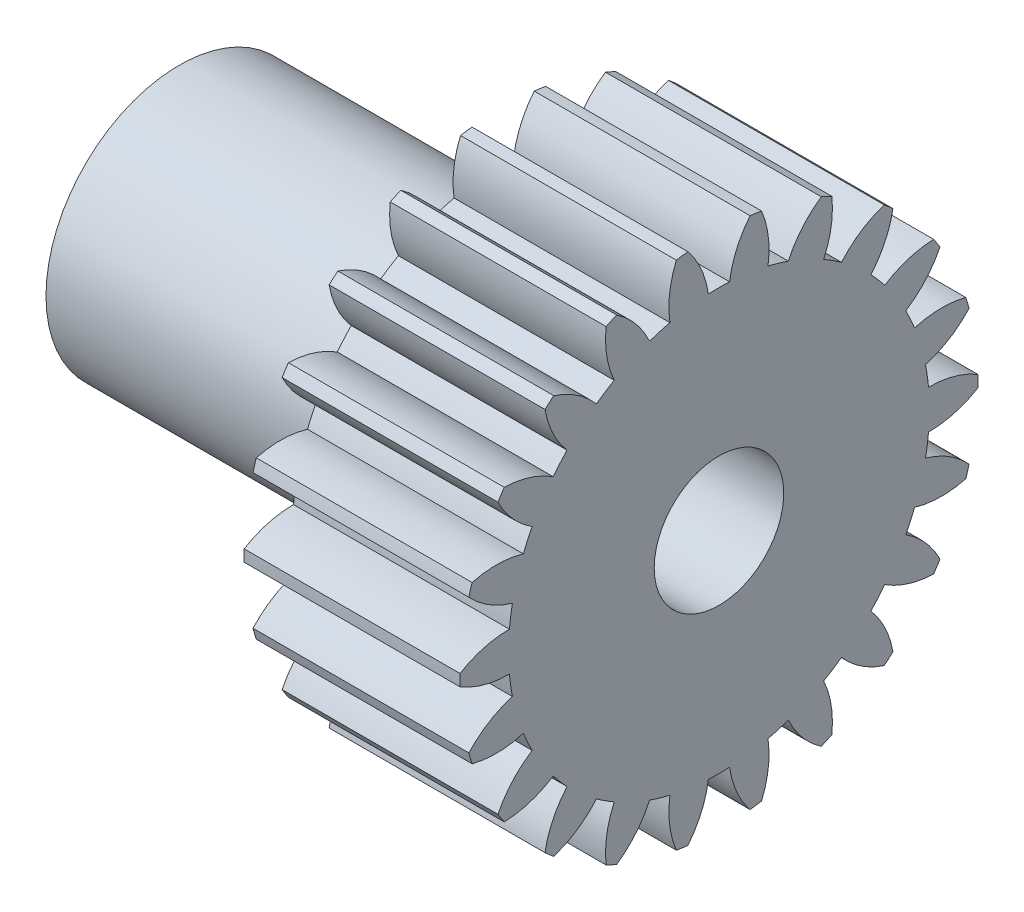
from build123d import *

# Parameters (mm, degrees)
BASPROSKE_W      = 10
BASPROSKE_H      = 12
TOOTHCUT_DEPTH   = 20.697715604
TEETHCUTS_COUNT  = 22
TEETHCUTS_ANGLE  = 343.636363636
HUBNEAONESKE_R   = 6.175
HUBNEARONE_DEPTH = 15.0000508
BORSKE_R         = 3
BORE_DEPTH       = 25.0000508


with BuildPart() as part:
    # BasProSke → Base-Revolve (revolve)
    with BuildSketch(Plane(origin=(0, 0, 0), x_dir=(1, 0, 0), z_dir=(0, 1, 0)), mode=Mode.PRIVATE) as base_revolve_sk:
        with Locations((5, 6)):
            Rectangle(BASPROSKE_W, BASPROSKE_H)
    revolve(base_revolve_sk.sketch.rotate(Axis((-10, 0, 0), (1, 0, 0)), 180), axis=Axis((-10, 0, 0), (1, 0, 0)))

    # TooCutSke → ToothCut (cut, through all)
    with BuildSketch(Plane(origin=(0, 0, 0), x_dir=(0, 0, -1), z_dir=(1, 0, 0))):
        with BuildLine():
            ThreePointArc((0.491001901, 9.736627657), (0, 9.749), (-0.491001901, 9.736627657))
            ThreePointArc((-0.491001901, 9.736627657), (-0.822824844, 10.904005344), (-1.46093845, 11.936327074))
            ThreePointArc((-1.46093845, 11.936327074), (0, 12.0254), (1.46093845, 11.936327074))
            ThreePointArc((1.46093845, 11.936327074), (0.822824844, 10.904005344), (0.491001901, 9.736627657))
        make_face()
    toothcut = extrude(amount=TOOTHCUT_DEPTH, mode=Mode.SUBTRACT)

    # TeethCuts: ToothCut ×22 about axis
    teethcuts_axis = Axis((-10, 0, 0), (1, 0, 0))
    for i in range(1, TEETHCUTS_COUNT):
        add(toothcut.rotate(teethcuts_axis, i * TEETHCUTS_ANGLE / (TEETHCUTS_COUNT - 1)), mode=Mode.SUBTRACT)

    # HubNeaOneSke → HubNearOne (add)
    with BuildSketch(Plane.ZY):
        with Locations(Location((0, 0, 0), (0, 0, 180))):
            Circle(HUBNEAONESKE_R)
    extrude(amount=HUBNEARONE_DEPTH)

    # BorSke → Bore (cut, symmetric)
    with BuildSketch(Plane(origin=(0, 0, 0), x_dir=(0, 0, -1), z_dir=(1, 0, 0))):
        with Locations(Location((0, 0, 0), (0, 0, 180))):
            Circle(BORSKE_R)
    extrude(amount=BORE_DEPTH, both=True, mode=Mode.SUBTRACT)


solid = part.part
